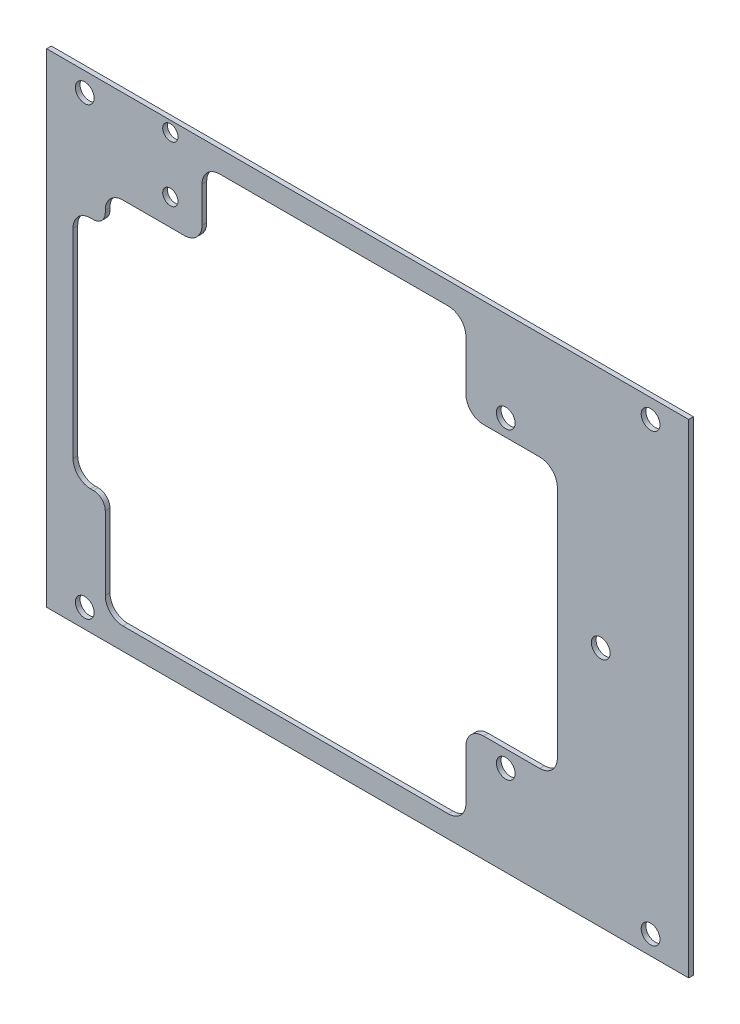
from build123d import *

# Parameters (mm, degrees)
SKETCH1_W           = 109.5
SKETCH1_H           = 82.5
SKETCH1_R           = 1.6
SKETCH1_R_2         = 1.3
BOSS_EXTRUDE1_DEPTH = 0.8
FILLET1_R           = 3
FILLET2_R           = 2


with BuildPart() as part:
    # Sketch1 → Boss-Extrude1 (new body)
    with BuildSketch(Plane.XY):
        with Locations((0, -41.75)):
            Rectangle(SKETCH1_W, SKETCH1_H)
        with Locations((23.55, -67.625)):
            Circle(SKETCH1_R, mode=Mode.SUBTRACT)
        with Locations((23.55, -15.875)):
            Circle(SKETCH1_R, mode=Mode.SUBTRACT)
        with Locations((48.25, -3.75)):
            Circle(SKETCH1_R, mode=Mode.SUBTRACT)
        with Locations((48.25, -79.75)):
            Circle(SKETCH1_R, mode=Mode.SUBTRACT)
        with Locations((-48.25, -79.75)):
            Circle(SKETCH1_R, mode=Mode.SUBTRACT)
        with Locations((-48.25, -3.75)):
            Circle(SKETCH1_R, mode=Mode.SUBTRACT)
        with Locations((-33.65, -2.32)):
            Circle(SKETCH1_R_2, mode=Mode.SUBTRACT)
        with Locations((-33.65, -11.85)):
            Circle(SKETCH1_R_2, mode=Mode.SUBTRACT)
        with Locations((39.75, -41.75)):
            Circle(SKETCH1_R, mode=Mode.SUBTRACT)
        Polygon((-50.25, -41.75), (-50.25, -61.75), (-44.75, -61.75), (-44.75, -79.25), (16.75, -79.25), (16.75, -64.75), (32.35, -64.75), (32.35, -18.75), (16.75, -18.75), (16.75, -4.25), (-28.25, -4.25), (-28.25, -16.35), (-44.75, -16.35), (-44.75, -21.75), (-50.25, -21.75), align=None, mode=Mode.SUBTRACT)
    extrude(amount=BOSS_EXTRUDE1_DEPTH)

    # Fillet1
    fillet1_edges = [part.edges().sort_by_distance(p)[0] for p in [
        (32.35, -64.75, 0.4),
        (32.35, -18.75, 0.4),
        (16.75, -18.75, 0.4),
        (16.75, -4.25, 0.4),
        (-28.25, -4.25, 0.4),
        (-28.25, -16.35, 0.4),
        (-44.75, -16.35, 0.4),
        (-50.25, -21.75, 0.4),
        (-50.25, -61.75, 0.4),
        (-44.75, -79.25, 0.4),
        (16.75, -79.25, 0.4),
        (16.75, -64.75, 0.4),
    ]]
    fillet(fillet1_edges, radius=FILLET1_R)

    # Fillet2
    fillet2_edges = [part.edges().sort_by_distance(p)[0] for p in [
        (-44.75, -21.75, 0.4),
        (-44.75, -61.75, 0.4),
    ]]
    fillet(fillet2_edges, radius=FILLET2_R)


solid = part.part
